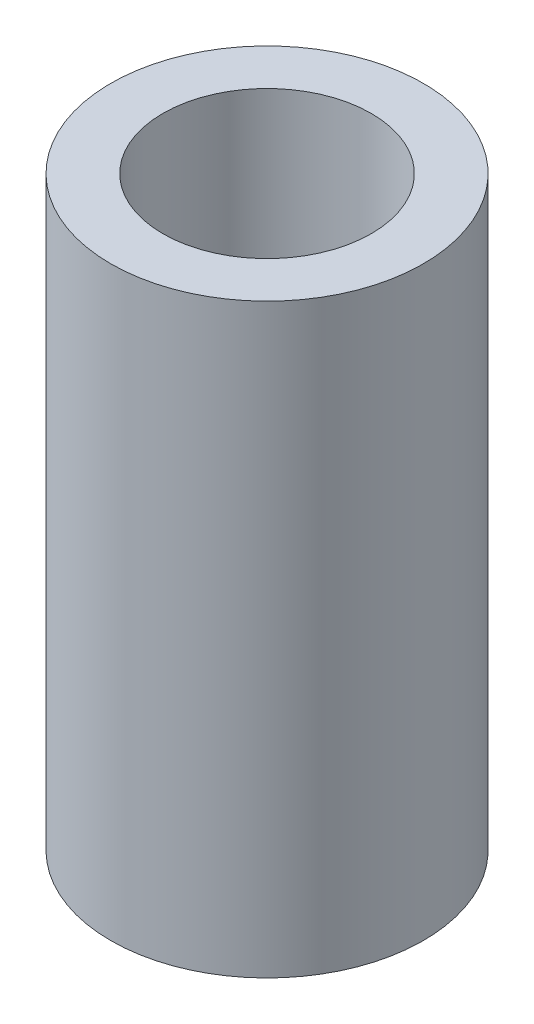
from build123d import *

# Parameters (mm, degrees)
SKETCH_1_R      = 2.4
SKETCH_1_R_2    = 1.6
EXTRUDE_1_DEPTH = 9


with BuildPart() as part:
    # Эскиз1 → Бобышка-Вытянуть1 (new body)
    with BuildSketch(Plane(origin=(0, 0, 0), x_dir=(1, 0, 0), z_dir=(0, 1, 0))):
        with Locations(Location((0, 0, 0), (0, 0, 270))):
            Circle(SKETCH_1_R)
        with Locations(Location((0, 0, 0), (0, 0, 270))):
            Circle(SKETCH_1_R_2, mode=Mode.SUBTRACT)
    extrude(amount=EXTRUDE_1_DEPTH)


solid = part.part
